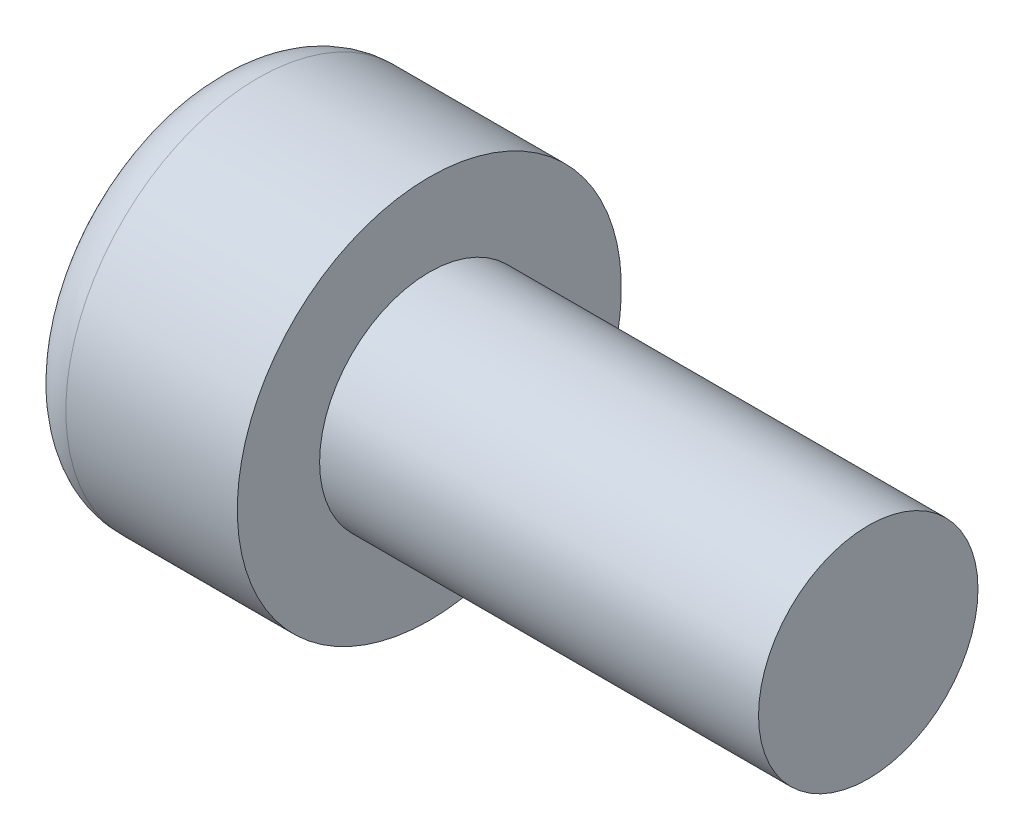
from build123d import *

# Parameters (mm, degrees)
CUT_EXTRUDE1_DEPTH = 2


with BuildPart() as part:
    # Sketch1 → Revolve1 (revolve)
    with BuildSketch(Plane.XY, mode=Mode.PRIVATE) as revolve1_sk:
        with BuildLine():
            Line((0, 0), (0, 2.625))
            ThreePointArc((0, 2.625), (0.256281566, 3.243718434), (0.875, 3.5))
            Line((0.875, 3.5), (4, 3.5))
            Line((4, 3.5), (4, 2))
            Line((4, 2), (12, 2))
            Line((12, 2), (12, 0))
            Line((12, 0), (0, 0))
        make_face()
    revolve(revolve1_sk.sketch.rotate(Axis((0, 0, 0), (1, 0, 0)), 180), axis=Axis((0, 0, 0), (1, 0, 0)))

    # Sketch2 → Cut-Extrude1 (cut)
    with BuildSketch(Plane.ZY):
        Polygon((0, 1.732050808), (-1.5, 0.866025404), (-1.5, -0.866025404), (0, -1.732050808), (1.5, -0.866025404), (1.5, 0.866025404), align=None)
    extrude(amount=-CUT_EXTRUDE1_DEPTH, mode=Mode.SUBTRACT)


solid = part.part
